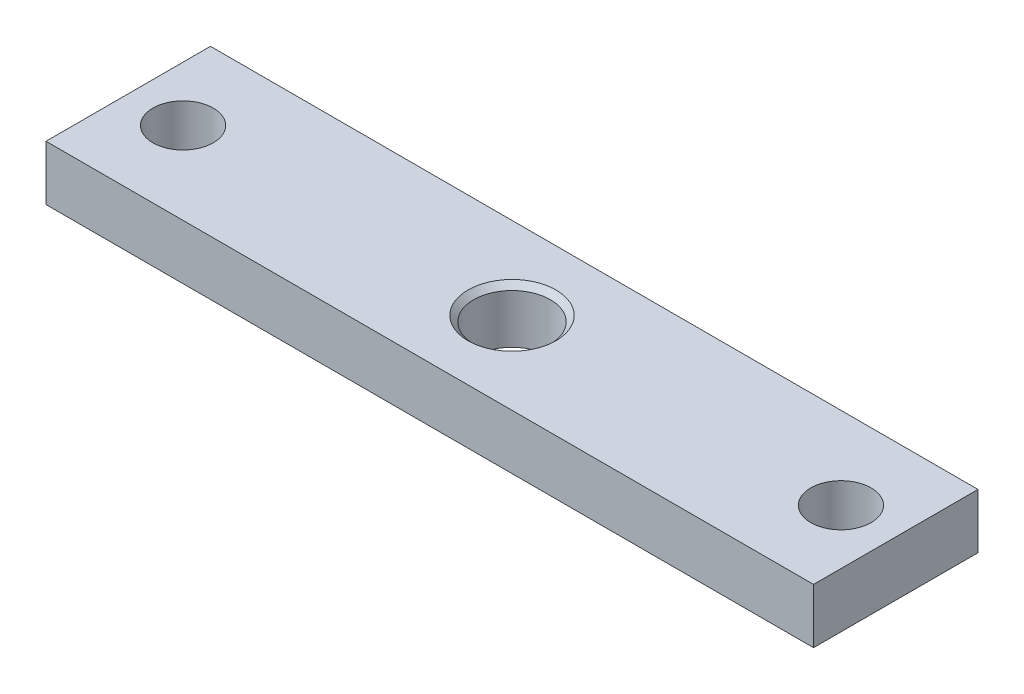
from build123d import *

# Parameters (mm, degrees)
SKETCH4_W                    = 140
SKETCH4_H                    = 30
BOSS_EXTRUDE2_DEPTH          = 5
SKETCH5_R                    = 5.5
CUT_EXTRUDE1_DEPTH           = 63
M16_TAPPED_HOLE1_D           = 14
M16_TAPPED_HOLE1_DEPTH       = 38
M16_TAPPED_HOLE1_CSINK_D     = 16.05
M16_TAPPED_HOLE1_CSINK_ANGLE = 90
M16_TAPPED_HOLE1_TIP         = 4.206024333


with BuildPart() as part:
    # Sketch4 → Boss-Extrude2 (new, symmetric)
    with BuildSketch(Plane(origin=(0, 0, 0), x_dir=(1, 0, 0), z_dir=(0, 1, 0))):
        Rectangle(SKETCH4_W, SKETCH4_H)
    extrude(amount=BOSS_EXTRUDE2_DEPTH, both=True)

    # Sketch5 → Cut-Extrude1 (cut)
    with BuildSketch(Plane(origin=(0, 5, 0), x_dir=(1, 0, 0), z_dir=(0, 1, 0))):
        with Locations(Location((-60, 0, 0), (0, 0, 270))):
            Circle(SKETCH5_R)
        with Locations(Location((60, 0, 0), (0, 0, 270))):
            Circle(SKETCH5_R)
    extrude(amount=-CUT_EXTRUDE1_DEPTH, mode=Mode.SUBTRACT)

    # M16 Tapped Hole1
    with Locations(Plane.ZX.offset(5)):
        with Locations((0, 0)):
            CounterSinkHole(M16_TAPPED_HOLE1_D / 2, M16_TAPPED_HOLE1_CSINK_D / 2, depth=M16_TAPPED_HOLE1_DEPTH, counter_sink_angle=M16_TAPPED_HOLE1_CSINK_ANGLE)
            with Locations((0, 0, -(M16_TAPPED_HOLE1_DEPTH + M16_TAPPED_HOLE1_TIP / 2))):  # 118° drill point
                Cone(0, M16_TAPPED_HOLE1_D / 2, M16_TAPPED_HOLE1_TIP, mode=Mode.SUBTRACT)


solid = part.part
